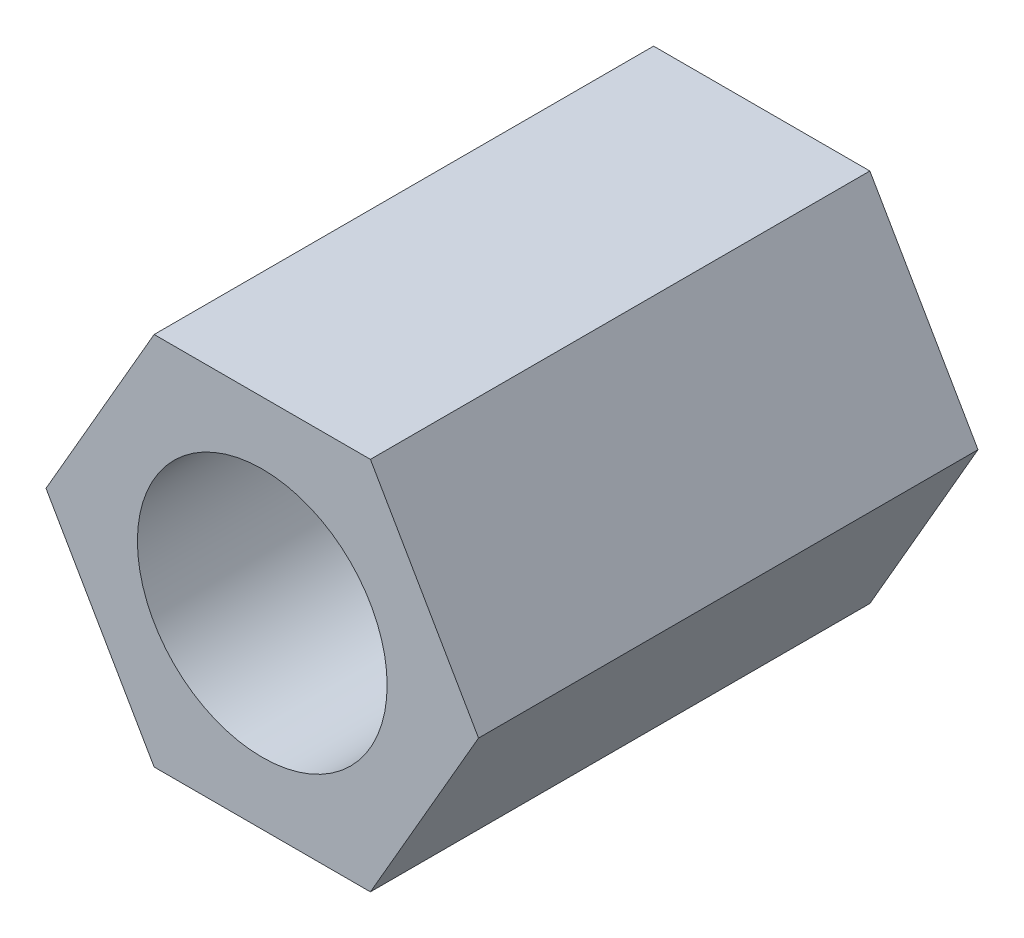
from build123d import *

# Parameters (mm, degrees)
SKETCH_1_R      = 1
EXTRUDE_1_DEPTH = 4


with BuildPart() as part:
    # 草图1 → 凸台-拉伸1 (new body)
    with BuildSketch(Plane.XY):
        Polygon((1.732050808, 0), (0.866025404, 1.5), (-0.866025404, 1.5), (-1.732050808, 0), (-0.866025404, -1.5), (0.866025404, -1.5), align=None)
        Circle(SKETCH_1_R, mode=Mode.SUBTRACT)
    extrude(amount=EXTRUDE_1_DEPTH)


solid = part.part
